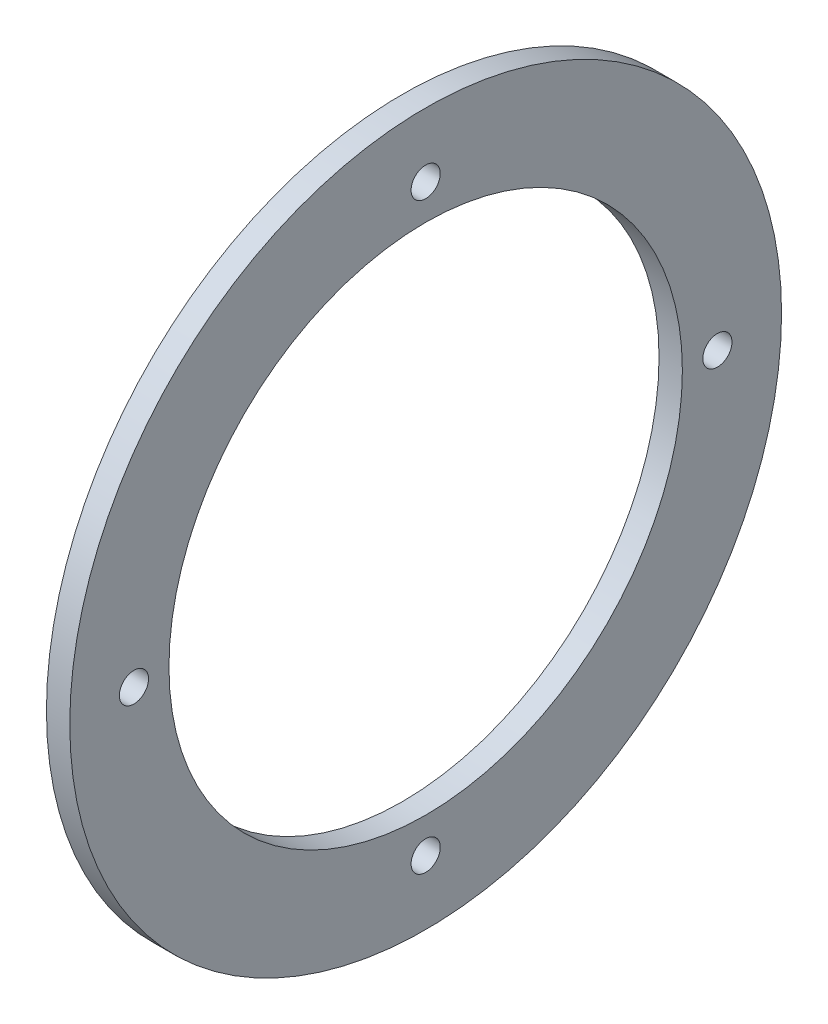
from build123d import *

# Parameters (mm, degrees)
SKETCH1_R           = 61
SKETCH1_R_2         = 44
SKETCH1_R_3         = 2.5
BOSS_EXTRUDE1_DEPTH = 4


with BuildPart() as part:
    # Sketch1 → Boss-Extrude1 (new body)
    with BuildSketch(Plane(origin=(0, 0, 0), x_dir=(0, 0, -1), z_dir=(1, 0, 0))):
        Circle(SKETCH1_R)
        Circle(SKETCH1_R_2, mode=Mode.SUBTRACT)
        with Locations((0, -50)):
            Circle(SKETCH1_R_3, mode=Mode.SUBTRACT)
        with Locations((0, 50)):
            Circle(SKETCH1_R_3, mode=Mode.SUBTRACT)
        with Locations((-50, 0)):
            Circle(SKETCH1_R_3, mode=Mode.SUBTRACT)
        with Locations((50, 0)):
            Circle(SKETCH1_R_3, mode=Mode.SUBTRACT)
    extrude(amount=BOSS_EXTRUDE1_DEPTH)


solid = part.part
